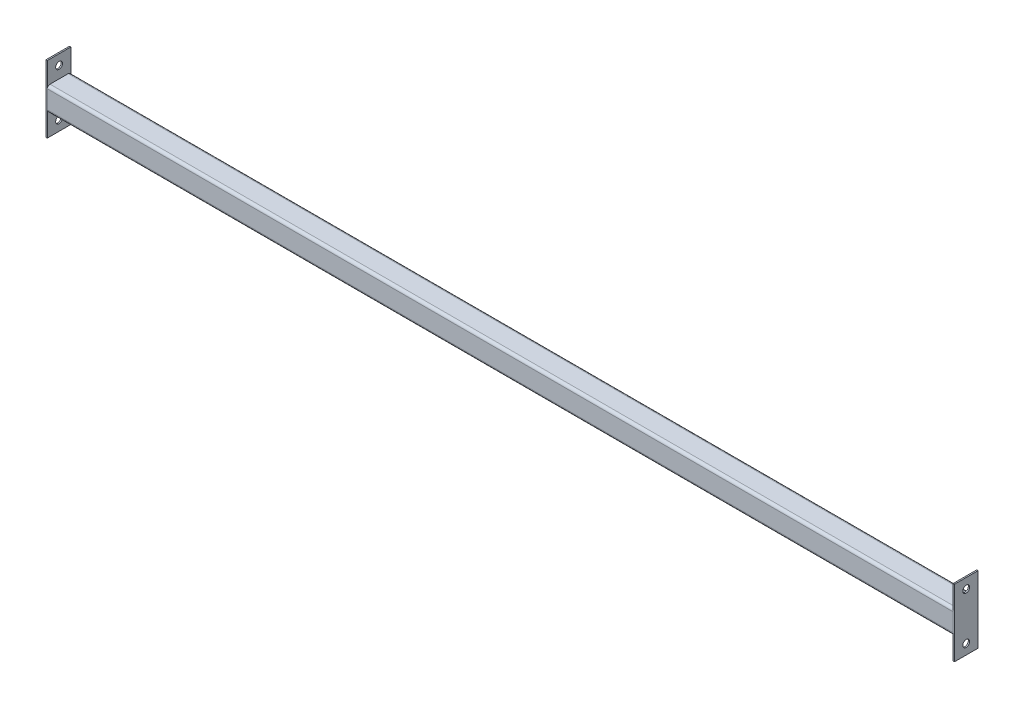
from build123d import *

# Parameters (mm, degrees)
SKETCH1_W                                    = 2
SKETCH1_H                                    = 35
SQUARE_TUBE_CONFIGURED_20_X_20_X_2_1_DEPTH   = 100
SKETCH1_ON_SEGMENT_2_W                       = 2
SKETCH1_ON_SEGMENT_2_H                       = 35
SQUARE_TUBE_CONFIGURED_20_X_20_X_2_1_2_DEPTH = 100
SQUARE_TUBE_CONFIGURED_20_X_20_X_2_3_DEPTH   = 1350
SKETCH13_W                                   = 5.1
SKETCH13_H                                   = 1352
F_10_2_10_2_DIAMETER_HOLE1_AT_2_COUNT        = 2
F_10_2_10_2_DIAMETER_HOLE1_AT_2_PITCH        = 70


with BuildPart() as part:
    # Sketch1 → Square tube - configured 20 X 20 X 2(1) (new body)
    with BuildSketch(Plane(origin=(0, 0, 0), x_dir=(1, 0, 0), z_dir=(0, 1, 0))):
        Rectangle(SKETCH1_W, SKETCH1_H)
    extrude(amount=SQUARE_TUBE_CONFIGURED_20_X_20_X_2_1_DEPTH)


with BuildPart() as body_2:
    # Sketch1 on segment 2 (carried to segment 2) → Square tube - configured 20 X 20 X 2_1 2 (new body)
    with BuildSketch(Plane(origin=(1350, 0, 0), x_dir=(1, 0, 0), z_dir=(0, 1, 0))):
        Rectangle(SKETCH1_ON_SEGMENT_2_W, SKETCH1_ON_SEGMENT_2_H)
    extrude(amount=SQUARE_TUBE_CONFIGURED_20_X_20_X_2_1_2_DEPTH)


with BuildPart() as body_3:
    # Sketch11 → Square tube - configured 20 X 20 X 2(3) (new body)
    with BuildSketch(Plane(origin=(0, 50, 0), x_dir=(0, 0, -1), z_dir=(1, 0, 0))):
        with BuildLine():
            Line((-13.5, -17.5), (13.5, -17.5))
            ThreePointArc((13.5, -17.5), (16.328427125, -16.328427125), (17.5, -13.5))
            Line((17.5, -13.5), (17.5, 13.5))
            ThreePointArc((17.5, 13.5), (16.328427125, 16.328427125), (13.5, 17.5))
            Line((13.5, 17.5), (-13.5, 17.5))
            ThreePointArc((-13.5, 17.5), (-16.328427125, 16.328427125), (-17.5, 13.5))
            Line((-17.5, 13.5), (-17.5, -13.5))
            ThreePointArc((-17.5, -13.5), (-16.328427125, -16.328427125), (-13.5, -17.5))
        make_face()
        with BuildLine():
            Line((-13.5, -15.5), (13.5, -15.5))
            ThreePointArc((13.5, -15.5), (14.914213562, -14.914213562), (15.5, -13.5))
            Line((15.5, -13.5), (15.5, 13.5))
            ThreePointArc((15.5, 13.5), (14.914213562, 14.914213562), (13.5, 15.5))
            Line((13.5, 15.5), (-13.5, 15.5))
            ThreePointArc((-13.5, 15.5), (-14.914213562, 14.914213562), (-15.5, 13.5))
            Line((-15.5, 13.5), (-15.5, -13.5))
            ThreePointArc((-15.5, -13.5), (-14.914213562, -14.914213562), (-13.5, -15.5))
        make_face(mode=Mode.SUBTRACT)
    extrude(amount=SQUARE_TUBE_CONFIGURED_20_X_20_X_2_3_DEPTH)

    # Trim/Extend1
    split(bisect_by=Plane(origin=(1349, 50, 0), x_dir=(0, -1, 0), z_dir=(-1, 0, 0)), keep=Keep.TOP)

    # Trim/Extend2
    split(bisect_by=Plane(origin=(1, 50, 0), x_dir=(0, 1, 0), z_dir=(1, 0, 0)), keep=Keep.TOP)


with BuildPart() as f_10_2_10_2_diameter_hole1_tool:
    # Sketch13 → Ø10.2 (10.2) Diameter Hole1 (revolve)
    with BuildSketch(Plane(origin=(-1, 15, 0), x_dir=(0, 0, 1), z_dir=(0, 1, 0))):
        with Locations((2.55, 676)):
            Rectangle(SKETCH13_W, SKETCH13_H)
    f_10_2_10_2_diameter_hole1 = revolve(axis=Axis((-7.35, 15, 0), (1, 0, 0)))


with BuildPart() as part_1:
    add(part.part)

    # Ø10.2 (10.2) Diameter Hole1: cut by f_10_2_10_2_diameter_hole1_tool
    add(f_10_2_10_2_diameter_hole1_tool.part, mode=Mode.SUBTRACT)


with BuildPart() as body_2_1:
    add(body_2.part)

    # Ø10.2 (10.2) Diameter Hole1: cut by f_10_2_10_2_diameter_hole1_tool
    add(f_10_2_10_2_diameter_hole1_tool.part, mode=Mode.SUBTRACT)


with BuildPart() as f_10_2_10_2_diameter_hole1_at_2_tool:
    # Ø10.2 (10.2) Diameter Hole1 at 2: Ø10.2 (10.2) Diameter Hole1 ×2
    with Locations(*[(0, i * F_10_2_10_2_DIAMETER_HOLE1_AT_2_PITCH, 0) for i in range(1, F_10_2_10_2_DIAMETER_HOLE1_AT_2_COUNT)]):
        add(f_10_2_10_2_diameter_hole1)


with BuildPart() as part_2:
    add(part_1.part)

    # Ø10.2 (10.2) Diameter Hole1 at 2: cut by f_10_2_10_2_diameter_hole1_at_2_tool
    add(f_10_2_10_2_diameter_hole1_at_2_tool.part, mode=Mode.SUBTRACT)


with BuildPart() as body_2_2:
    add(body_2_1.part)

    # Ø10.2 (10.2) Diameter Hole1 at 2: cut by f_10_2_10_2_diameter_hole1_at_2_tool
    add(f_10_2_10_2_diameter_hole1_at_2_tool.part, mode=Mode.SUBTRACT)


solid = Compound([body_3.part, part_2.part, body_2_2.part])
